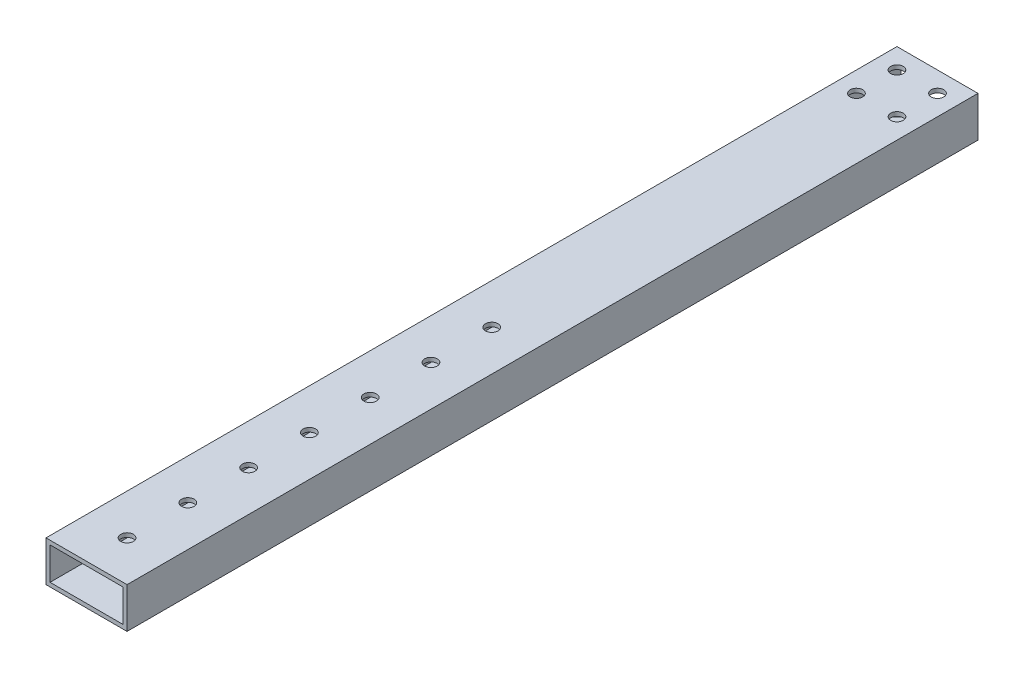
from build123d import *

# Parameters (mm, degrees)
SKETCH_1_W          = 20
SKETCH_1_H          = 10
SKETCH_1_W_2        = 18
SKETCH_1_H_2        = 8
EXTRUDE_1_DEPTH     = 210
SKETCH_2_R          = 1.55
CUT_EXTRUDE_1_DEPTH = 212.187120819
SKETCH_3_R          = 1.55
CUT_EXTRUDE_2_DEPTH = 212.187120819


with BuildPart() as part:
    # 草图1 → 凸台-拉伸1 (new body)
    with BuildSketch(Plane.XY):
        with Locations((10, 5)):
            Rectangle(SKETCH_1_W, SKETCH_1_H)
        with Locations((10, 5)):
            Rectangle(SKETCH_1_W_2, SKETCH_1_H_2, mode=Mode.SUBTRACT)
    extrude(amount=EXTRUDE_1_DEPTH)

    # 草图2 → 切除-拉伸1 (cut, through all)
    with BuildSketch(Plane.XZ):
        with Locations(Location((5, 5, 0), (0, 0, 270))):
            Circle(SKETCH_2_R)
        with Locations(Location((15, 5, 0), (0, 0, 270))):
            Circle(SKETCH_2_R)
        with Locations(Location((15, 15, 0), (0, 0, 270))):
            Circle(SKETCH_2_R)
        with Locations(Location((5, 15, 0), (0, 0, 270))):
            Circle(SKETCH_2_R)
    extrude(amount=-CUT_EXTRUDE_1_DEPTH, mode=Mode.SUBTRACT)

    # 草图3 → 切除-拉伸2 (cut, through all)
    with BuildSketch(Plane.XZ):
        with Locations(Location((10, 200, 0), (0, 0, 270))):
            Circle(SKETCH_3_R)
        with Locations(Location((10, 185, 0), (0, 0, 270))):
            Circle(SKETCH_3_R)
        with Locations(Location((10, 170, 0), (0, 0, 270))):
            Circle(SKETCH_3_R)
        with Locations(Location((10, 155, 0), (0, 0, 270))):
            Circle(SKETCH_3_R)
        with Locations(Location((10, 140, 0), (0, 0, 270))):
            Circle(SKETCH_3_R)
        with Locations(Location((10, 125, 0), (0, 0, 270))):
            Circle(SKETCH_3_R)
        with Locations(Location((10, 110, 0), (0, 0, 270))):
            Circle(SKETCH_3_R)
    extrude(amount=-CUT_EXTRUDE_2_DEPTH, mode=Mode.SUBTRACT)


solid = part.part
